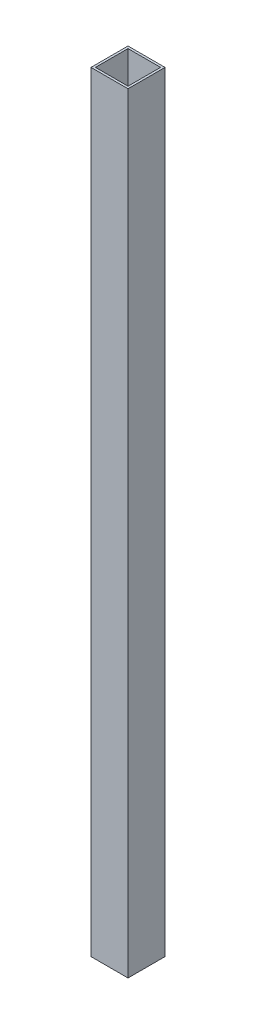
from build123d import *

# Parameters (mm, degrees)
SKETCH1_W           = 12.5
SKETCH1_H           = 12.5
SKETCH1_W_2         = 11
SKETCH1_H_2         = 11
BOSS_EXTRUDE3_DEPTH = 260


with BuildPart() as part:
    # Sketch1 → Boss-Extrude3 (new body)
    with BuildSketch(Plane(origin=(0, 0, 0), x_dir=(1, 0, 0), z_dir=(0, 1, 0))):
        with Locations((-20.377754415, -4.412827368)):
            Rectangle(SKETCH1_W, SKETCH1_H)
        with Locations((-20.377754415, -4.412827368)):
            Rectangle(SKETCH1_W_2, SKETCH1_H_2, mode=Mode.SUBTRACT)
    extrude(amount=BOSS_EXTRUDE3_DEPTH)


solid = part.part
